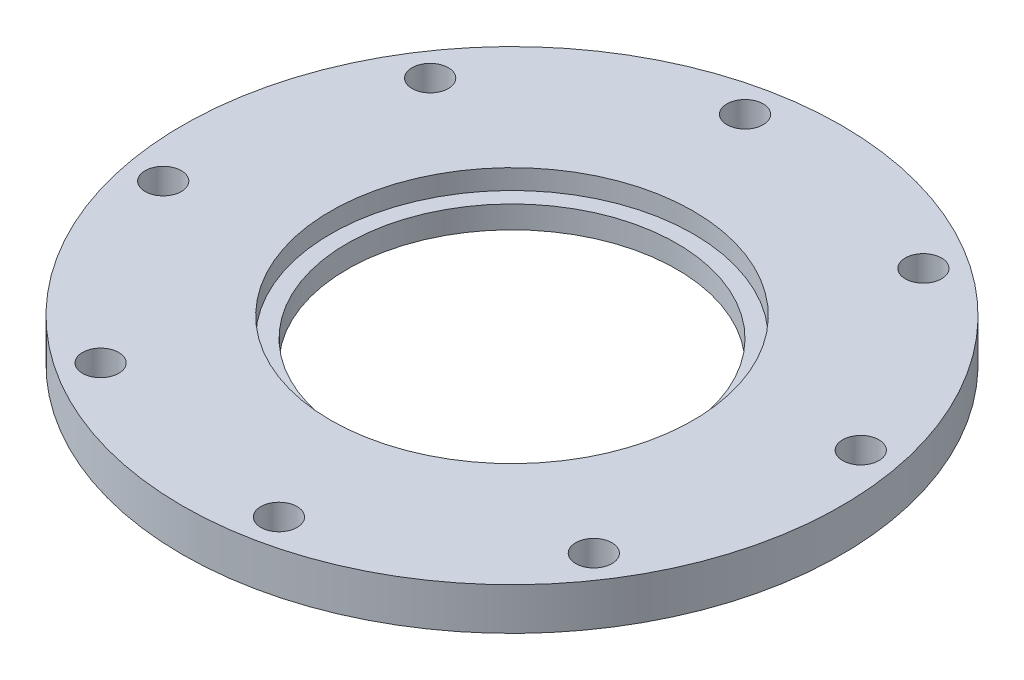
from build123d import *

# Parameters (mm, degrees)
SKETCH1_R           = 50
SKETCH1_R_2         = 25
SKETCH1_R_3         = 2.9
BOSS_EXTRUDE1_DEPTH = 3.4
SKETCH2_R           = 50
SKETCH2_R_2         = 27.5
BOSS_EXTRUDE2_DEPTH = 3
SKETCH3_R           = 2
CUT_EXTRUDE1_DEPTH  = 6.4
SKETCH4_R           = 2.75
CUT_EXTRUDE2_DEPTH  = 5


with BuildPart() as part:
    # Sketch1 → Boss-Extrude1 (new body)
    with BuildSketch(Plane(origin=(0, 0, 0), x_dir=(1, 0, 0), z_dir=(0, 1, 0))):
        with Locations(Location((0, 0, 0), (0, 0, 270))):
            Circle(SKETCH1_R)
        with Locations(Location((0, 0, 0), (0, 0, 270))):
            Circle(SKETCH1_R_2, mode=Mode.SUBTRACT)
        with Locations(Location((0, 35, 0), (0, 0, 270))):
            Circle(SKETCH1_R_3, mode=Mode.SUBTRACT)
        with Locations(Location((13.393920133, 32.335783638, 0), (0, 0, 270))):
            Circle(SKETCH1_R_3, mode=Mode.SUBTRACT)
        with Locations(Location((24.748737342, 24.748737342, 0), (0, 0, 270))):
            Circle(SKETCH1_R_3, mode=Mode.SUBTRACT)
        with Locations(Location((32.335783638, 13.393920133, 0), (0, 0, 270))):
            Circle(SKETCH1_R_3, mode=Mode.SUBTRACT)
        with Locations(Location((35, 0, 0), (0, 0, 270))):
            Circle(SKETCH1_R_3, mode=Mode.SUBTRACT)
        with Locations(Location((32.335783638, -13.393920133, 0), (0, 0, 270))):
            Circle(SKETCH1_R_3, mode=Mode.SUBTRACT)
        with Locations(Location((24.748737342, -24.748737342, 0), (0, 0, 270))):
            Circle(SKETCH1_R_3, mode=Mode.SUBTRACT)
        with Locations(Location((13.393920133, -32.335783638, 0), (0, 0, 270))):
            Circle(SKETCH1_R_3, mode=Mode.SUBTRACT)
        with Locations(Location((0, -35, 0), (0, 0, 270))):
            Circle(SKETCH1_R_3, mode=Mode.SUBTRACT)
        with Locations(Location((-13.393920133, -32.335783638, 0), (0, 0, 270))):
            Circle(SKETCH1_R_3, mode=Mode.SUBTRACT)
        with Locations(Location((-24.748737342, -24.748737342, 0), (0, 0, 270))):
            Circle(SKETCH1_R_3, mode=Mode.SUBTRACT)
        with Locations(Location((-32.335783638, -13.393920133, 0), (0, 0, 270))):
            Circle(SKETCH1_R_3, mode=Mode.SUBTRACT)
        with Locations(Location((-35, 0, 0), (0, 0, 270))):
            Circle(SKETCH1_R_3, mode=Mode.SUBTRACT)
        with Locations(Location((-32.335783638, 13.393920133, 0), (0, 0, 270))):
            Circle(SKETCH1_R_3, mode=Mode.SUBTRACT)
        with Locations(Location((-24.748737342, 24.748737342, 0), (0, 0, 270))):
            Circle(SKETCH1_R_3, mode=Mode.SUBTRACT)
        with Locations(Location((-13.393920133, 32.335783638, 0), (0, 0, 270))):
            Circle(SKETCH1_R_3, mode=Mode.SUBTRACT)
    extrude(amount=BOSS_EXTRUDE1_DEPTH)

    # Sketch2 → Boss-Extrude2 (add)
    with BuildSketch(Plane(origin=(0, 3.4, 0), x_dir=(1, 0, 0), z_dir=(0, 1, 0))):
        with Locations(Location((0, 0, 0), (0, 0, 270))):
            Circle(SKETCH2_R)
        with Locations(Location((0, 0, 0), (0, 0, 270))):
            Circle(SKETCH2_R_2, mode=Mode.SUBTRACT)
    extrude(amount=BOSS_EXTRUDE2_DEPTH)

    # Sketch3 → Cut-Extrude1 (cut)
    with BuildSketch(Plane.XZ):
        with Locations(Location((-37.416132554, -25.000660486, 0), (0, 0, 270))):
            Circle(SKETCH3_R)
        with Locations(Location((37.416132554, 25.000660486, 0), (0, 0, 270))):
            Circle(SKETCH3_R)
        with Locations(Location((44.135337618, -8.779064491, 0), (0, 0, 270))):
            Circle(SKETCH3_R)
        with Locations(Location((25.000660486, -37.416132554, 0), (0, 0, 270))):
            Circle(SKETCH3_R)
        with Locations(Location((-8.779064491, -44.135337618, 0), (0, 0, 270))):
            Circle(SKETCH3_R)
        with Locations(Location((-44.135337618, 8.779064491, 0), (0, 0, 270))):
            Circle(SKETCH3_R)
        with Locations(Location((-25.000660486, 37.416132554, 0), (0, 0, 270))):
            Circle(SKETCH3_R)
        with Locations(Location((8.779064491, 44.135337618, 0), (0, 0, 270))):
            Circle(SKETCH3_R)
    extrude(amount=-CUT_EXTRUDE1_DEPTH, mode=Mode.SUBTRACT)

    # Sketch4 → Cut-Extrude2 (cut)
    with BuildSketch(Plane(origin=(0, 6.4, 0), x_dir=(1, 0, 0), z_dir=(0, 1, 0))):
        with Locations(Location((-8.779064491, 44.135337618, 0), (0, 0, 270))):
            Circle(SKETCH4_R)
        with Locations(Location((25.000660486, 37.416132554, 0), (0, 0, 270))):
            Circle(SKETCH4_R)
        with Locations(Location((44.135337618, 8.779064491, 0), (0, 0, 270))):
            Circle(SKETCH4_R)
        with Locations(Location((37.416132554, -25.000660486, 0), (0, 0, 270))):
            Circle(SKETCH4_R)
        with Locations(Location((8.779064491, -44.135337618, 0), (0, 0, 270))):
            Circle(SKETCH4_R)
        with Locations(Location((-25.000660486, -37.416132554, 0), (0, 0, 270))):
            Circle(SKETCH4_R)
        with Locations(Location((-44.135337618, -8.779064491, 0), (0, 0, 270))):
            Circle(SKETCH4_R)
        with Locations(Location((-37.416132554, 25.000660486, 0), (0, 0, 270))):
            Circle(SKETCH4_R)
    extrude(amount=-CUT_EXTRUDE2_DEPTH, mode=Mode.SUBTRACT)


solid = part.part
